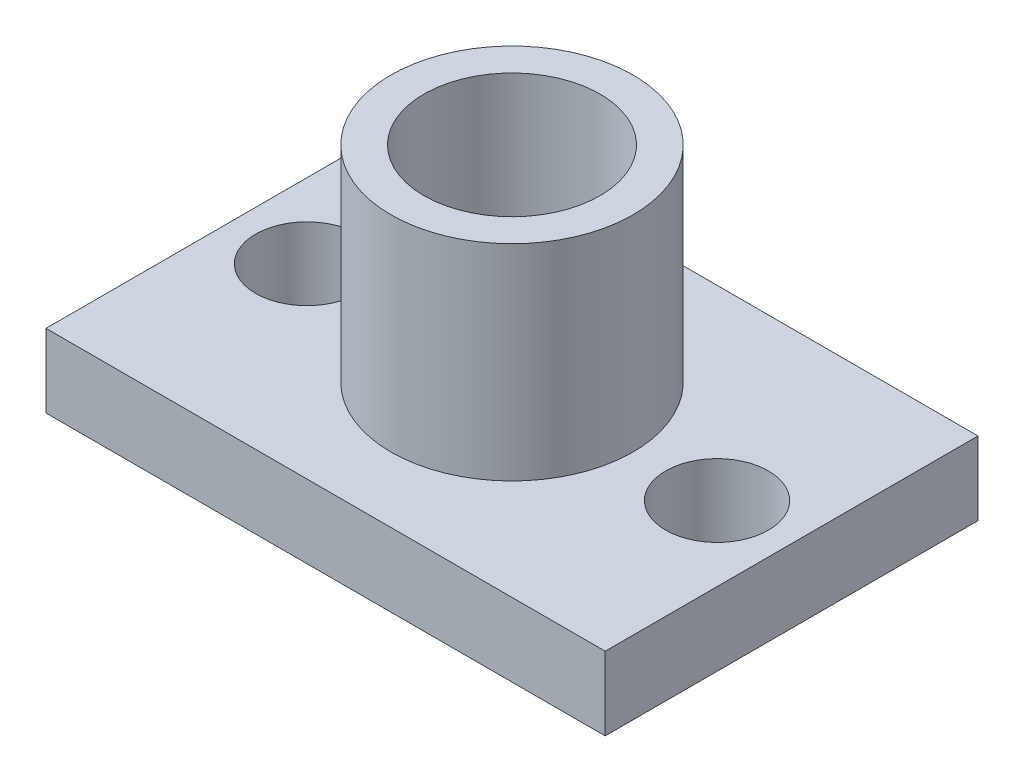
from build123d import *

# Parameters (mm, degrees)
SKETCH1_W           = 38.1
SKETCH1_H           = 25.4
BOSS_EXTRUDE1_DEPTH = 5
SKETCH3_R           = 8.25
SKETCH3_R_2         = 6
BOSS_EXTRUDE2_DEPTH = 14
SKETCH4_R           = 3.5
CUT_EXTRUDE1_DEPTH  = 33.016956153


with BuildPart() as part:
    # Sketch1 → Boss-Extrude1 (new body)
    with BuildSketch(Plane(origin=(0, 0, 0), x_dir=(1, 0, 0), z_dir=(0, 1, 0))):
        with Locations((-6.79173913, 0)):
            Rectangle(SKETCH1_W, SKETCH1_H)
    extrude(amount=BOSS_EXTRUDE1_DEPTH)

    # Sketch3 → Boss-Extrude2 (add)
    with BuildSketch(Plane(origin=(0, 5, 0), x_dir=(1, 0, 0), z_dir=(0, 1, 0))):
        with Locations((-6.79173913, 0)):
            Circle(SKETCH3_R)
        with Locations((-6.79173913, 0)):
            Circle(SKETCH3_R_2, mode=Mode.SUBTRACT)
    extrude(amount=BOSS_EXTRUDE2_DEPTH)

    # Sketch4 → Cut-Extrude1 (cut, through all)
    with BuildSketch(Plane(origin=(0, 5, 0), x_dir=(1, 0, 0), z_dir=(0, 1, 0))):
        with Locations((7.17826087, 0)):
            Circle(SKETCH4_R)
        with Locations((-20.76173913, 0)):
            Circle(SKETCH4_R)
    extrude(amount=-CUT_EXTRUDE1_DEPTH, mode=Mode.SUBTRACT)


solid = part.part
